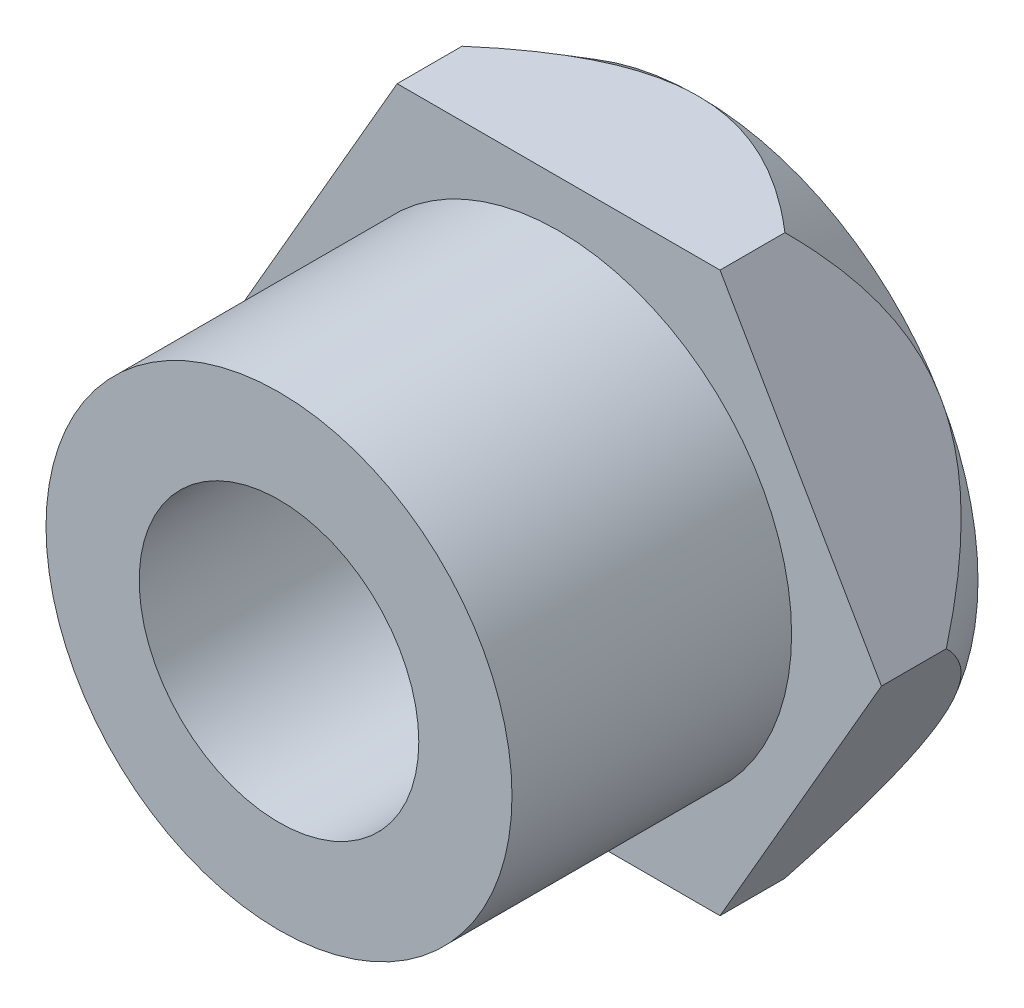
from build123d import *

# Parameters (mm, degrees)
SKETCH1_R           = 5
BOSS_EXTRUDE1_DEPTH = 6
BOSS_EXTRUDE2_DEPTH = 3
SKETCH2_R           = 3
CUT_EXTRUDE1_DEPTH  = 21
SKETCH4_OUTSIDE_W   = 66.706
SKETCH4_OUTSIDE_H   = 64.85
SKETCH4_OUTSIDE_R   = 6
CUT_EXTRUDE3_DEPTH  = 40.5
CUT_EXTRUDE3_DRAFT  = -30


with BuildPart() as part:
    # Sketch1 → Boss-Extrude1 (new body)
    with BuildSketch(Plane.XY):
        Circle(SKETCH1_R)
    extrude(amount=BOSS_EXTRUDE1_DEPTH)


with BuildPart() as body_2:
    # Sketch1<3> → Boss-Extrude2 (new body)
    with BuildSketch(Plane.XY):
        Polygon((3.464101615, -6), (6.92820323, 0), (3.464101615, 6), (-3.464101615, 6), (-6.92820323, 0), (-3.464101615, -6), align=None)
    extrude(amount=-BOSS_EXTRUDE2_DEPTH)


with BuildPart() as cut_extrude1_tool:
    # Sketch2 → Cut-Extrude1 (new body)
    with BuildSketch(Plane(origin=(0, 0, -3), x_dir=(-1, 0, 0), z_dir=(0, 0, -1))):
        Circle(SKETCH2_R)
    extrude(amount=-CUT_EXTRUDE1_DEPTH)


with BuildPart() as part_1:
    add(part.part)

    # Cut-Extrude1: cut by cut_extrude1_tool
    add(cut_extrude1_tool.part, mode=Mode.SUBTRACT)


with BuildPart() as body_2_1:
    add(body_2.part)

    # Cut-Extrude1: cut by cut_extrude1_tool
    add(cut_extrude1_tool.part, mode=Mode.SUBTRACT)


with BuildPart() as cut_extrude3_tool:
    # Sketch4 outside → Cut-Extrude3 (with draft: the straight prism first)
    with BuildSketch(Plane(origin=(0, 0, -3), x_dir=(-1, 0, 0), z_dir=(0, 0, -1))):
        Rectangle(SKETCH4_OUTSIDE_W, SKETCH4_OUTSIDE_H)
        Circle(SKETCH4_OUTSIDE_R, mode=Mode.SUBTRACT)
    extrude(amount=-CUT_EXTRUDE3_DEPTH)
    # Cut-Extrude3: the draft: its side faces are tilted about the plane it starts from
    cut_extrude3_sides = [cut_extrude3_tool.faces().sort_by_distance(p)[0] for p in [
        (0, -32.425, 17.25),
        (-33.353, 0, 17.25),
        (0, 32.425, 17.25),
        (33.353, 0, 17.25),
        (6, 0, 17.25),
    ]]
    draft(cut_extrude3_sides, Plane(origin=(0, 0, -3), x_dir=(-1, 0, 0), z_dir=(0, 0, -1)), CUT_EXTRUDE3_DRAFT)


with BuildPart() as body_2_2:
    add(body_2_1.part)

    # Cut-Extrude3: cut by cut_extrude3_tool
    add(cut_extrude3_tool.part, mode=Mode.SUBTRACT)


solid = Compound([part_1.part, body_2_2.part])
